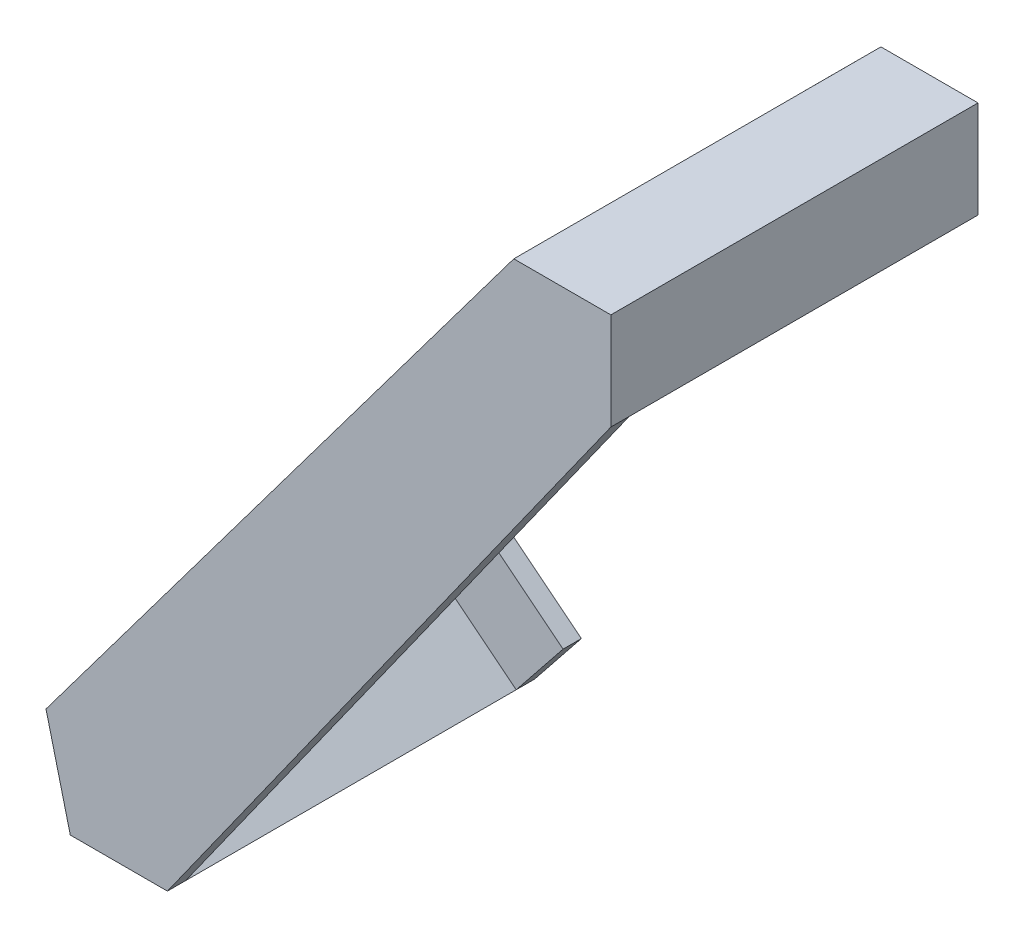
from build123d import *

# Parameters (mm, degrees)
BOSS_EXTRUDE1_DEPTH = 2
BOSS_EXTRUDE2_DEPTH = 38.1
BOSS_EXTRUDE3_DEPTH = 2


with BuildPart() as part:
    # Sketch1 → Boss-Extrude1 (new body)
    with BuildSketch(Plane.XY):
        Polygon((29.528587169, 36.011013454), (-21.569396066, -32.119630858), (-18.916193719, -42.719630858), (-8.306193719, -42.719630858), (40.131789515, 25.401013454), (40.131789515, 36.011013454), align=None)
    extrude(amount=BOSS_EXTRUDE1_DEPTH)

    # Sketch2 → Boss-Extrude2 (add)
    with BuildSketch(Plane(origin=(0, 0, 0), x_dir=(-1, 0, 0), z_dir=(0, 0, -1))):
        Polygon((-40.131789515, 25.401013454), (-29.528587169, 36.011013454), (-40.131789515, 36.011013454), align=None)
        Polygon((8.306193719, -42.719630858), (21.569396066, -32.119630858), (18.916193719, -42.719630858), align=None)
    extrude(amount=BOSS_EXTRUDE2_DEPTH)

    # Sketch3 → Boss-Extrude3 (add)
    with BuildSketch(Plane(origin=(0, 0, -38.1), x_dir=(-1, 0, 0), z_dir=(0, 0, -1))):
        Polygon((21.569396066, -32.119630858), (8.306193719, -42.719630858), (3.194123868, -36.323176439), (16.457326214, -25.723176439), align=None)
        Polygon((-29.528587169, 36.011013454), (-40.131789515, 25.401013454), (-33.863813996, 19.137053724), (-23.260611649, 29.747053724), align=None)
    extrude(amount=-BOSS_EXTRUDE3_DEPTH)


solid = part.part
